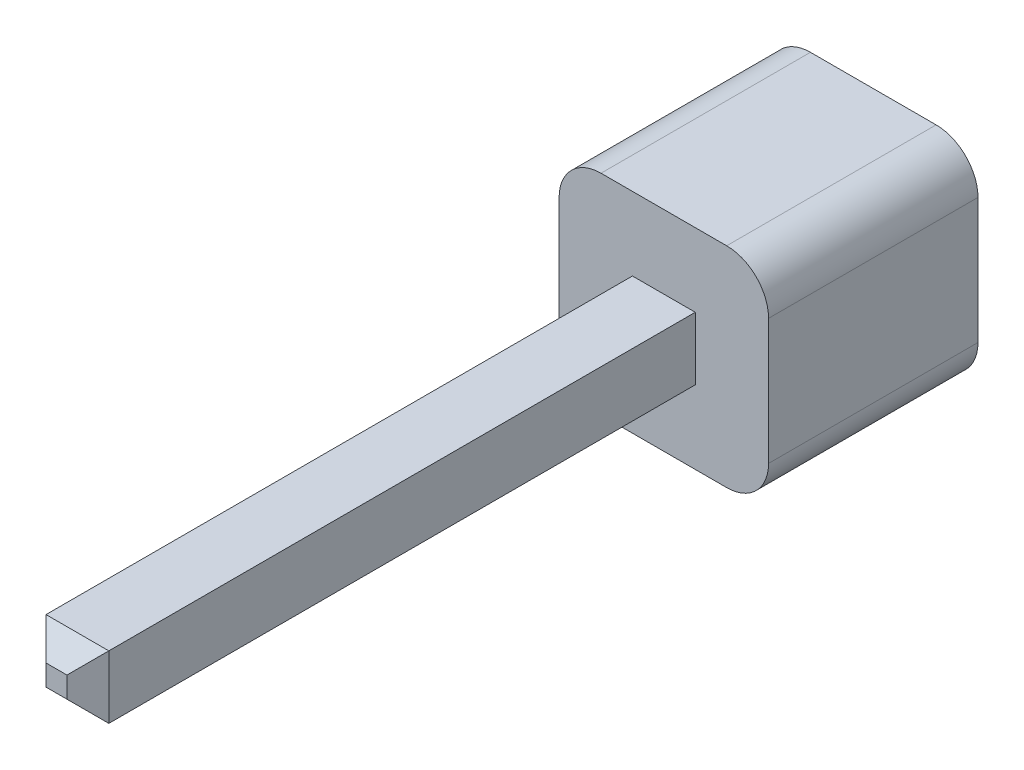
from build123d import *

# Parameters (mm, degrees)
SKETCH_2_W          = 2.54
SKETCH_2_H          = 2.54
EXTRUDE_1_DEPTH     = 2.54
FILLET_1_R          = 0.508
EXTRUDE_2_DEPTH     = 7.366
CUT_EXTRUDE_1_DEPTH = 8.96463163
CUT_EXTRUDE_3_DEPTH = 8.96463163


with BuildPart() as part:
    # 草图2 → 凸台-拉伸1 (new body)
    with BuildSketch(Plane.XY):
        with Locations((1.27, 1.27)):
            Rectangle(SKETCH_2_W, SKETCH_2_H)
    extrude(amount=-EXTRUDE_1_DEPTH)

    # 圆角1
    fillet_1_edges = [part.edges().sort_by_distance(p)[0] for p in [
        (0, 2.54, -1.27),
        (2.54, 2.54, -1.27),
        (2.54, 0, -1.27),
        (0, 0, -1.27),
    ]]
    fillet(fillet_1_edges, radius=FILLET_1_R)

    # 草图3 → 凸台-拉伸2 (add)
    with BuildSketch(Plane.XY):
        Polygon((1.651, 1.27), (1.651, 1.651), (0.889, 1.651), (0.889, 0.889), (1.651, 0.889), align=None)
    extrude(amount=EXTRUDE_2_DEPTH)

    # 草图4 → 切除-拉伸1 (cut, through all)
    with BuildSketch(Plane(origin=(1.651, 0, 0), x_dir=(0, 0, -1), z_dir=(1, 0, 0))):
        Polygon((-7.366, 0.889), (-7.366, 1.143), (-7.112, 0.889), align=None)
        Polygon((-7.366, 1.397), (-7.112, 1.651), (-7.366, 1.651), align=None)
    extrude(amount=-CUT_EXTRUDE_1_DEPTH, mode=Mode.SUBTRACT)

    # 草图6 → 切除-拉伸3 (cut, through all)
    with BuildSketch(Plane(origin=(0, 0.889, 0), x_dir=(-1, 0, 0), z_dir=(0, -1, 0))):
        Polygon((-1.143, -7.366), (-0.889, -7.112), (-0.889, -7.366), align=None)
        Polygon((-1.651, -7.366), (-1.397, -7.366), (-1.651, -7.112), align=None)
    extrude(amount=-CUT_EXTRUDE_3_DEPTH, mode=Mode.SUBTRACT)


solid = part.part
